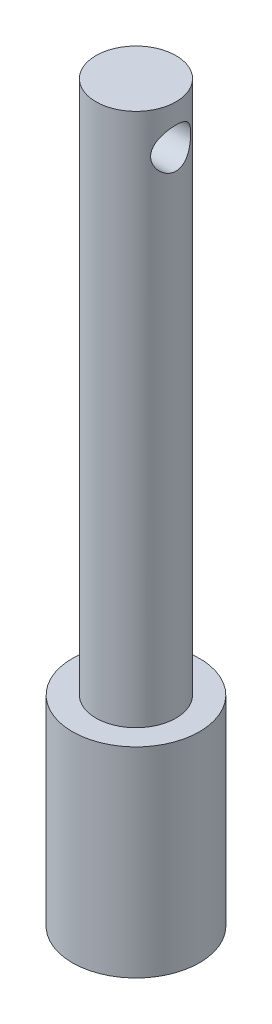
from build123d import *

# Parameters (mm, degrees)
SKETCH5_R                      = 9.525
BOSS_EXTRUDE4_DEPTH            = 30
SKETCH6_R                      = 6
BOSS_EXTRUDE6_DEPTH            = 110
CUT_EXTRUDE1_REACH             = 112.822
SKETCH7_R                      = 3
CUT_EXTRUDE1_DIRECTION_2_REACH = 112.822


with BuildPart() as part:
    # Sketch5 → Boss-Extrude4 (new body)
    with BuildSketch(Plane(origin=(0, 0, 0), x_dir=(1, 0, 0), z_dir=(0, 1, 0))):
        Circle(SKETCH5_R)
    extrude(amount=BOSS_EXTRUDE4_DEPTH)

    # Sketch6 → Boss-Extrude6 (add)
    with BuildSketch(Plane(origin=(0, 0, 0), x_dir=(1, 0, 0), z_dir=(0, 1, 0))):
        Circle(SKETCH6_R)
    extrude(amount=BOSS_EXTRUDE6_DEPTH)

    # Sketch7 → Cut-Extrude1 (cut, up to next)
    with BuildSketch(Plane(origin=(0, 0, 0), x_dir=(0, 0, -1), z_dir=(1, 0, 0)), mode=Mode.PRIVATE) as cut_extrude1_sk1:
        with Locations((0, 104)):
            Circle(SKETCH7_R)
    cut_extrude1_tool1 = extrude(cut_extrude1_sk1.sketch, amount=-CUT_EXTRUDE1_REACH, mode=Mode.PRIVATE) & part.part
    add(cut_extrude1_tool1.solids().sort_by_distance((0, 104, 0))[0], mode=Mode.SUBTRACT)

    # Sketch7 → Cut-Extrude1 direction 2 (cut, up to next)
    with BuildSketch(Plane(origin=(0, 0, 0), x_dir=(0, 0, -1), z_dir=(1, 0, 0)), mode=Mode.PRIVATE) as cut_extrude1_direction_2_sk1:
        with Locations((0, 104)):
            Circle(SKETCH7_R)
    cut_extrude1_direction_2_tool1 = extrude(cut_extrude1_direction_2_sk1.sketch, amount=CUT_EXTRUDE1_DIRECTION_2_REACH, mode=Mode.PRIVATE) & part.part
    add(cut_extrude1_direction_2_tool1.solids().sort_by_distance((0, 104, 0))[0], mode=Mode.SUBTRACT)


solid = part.part
